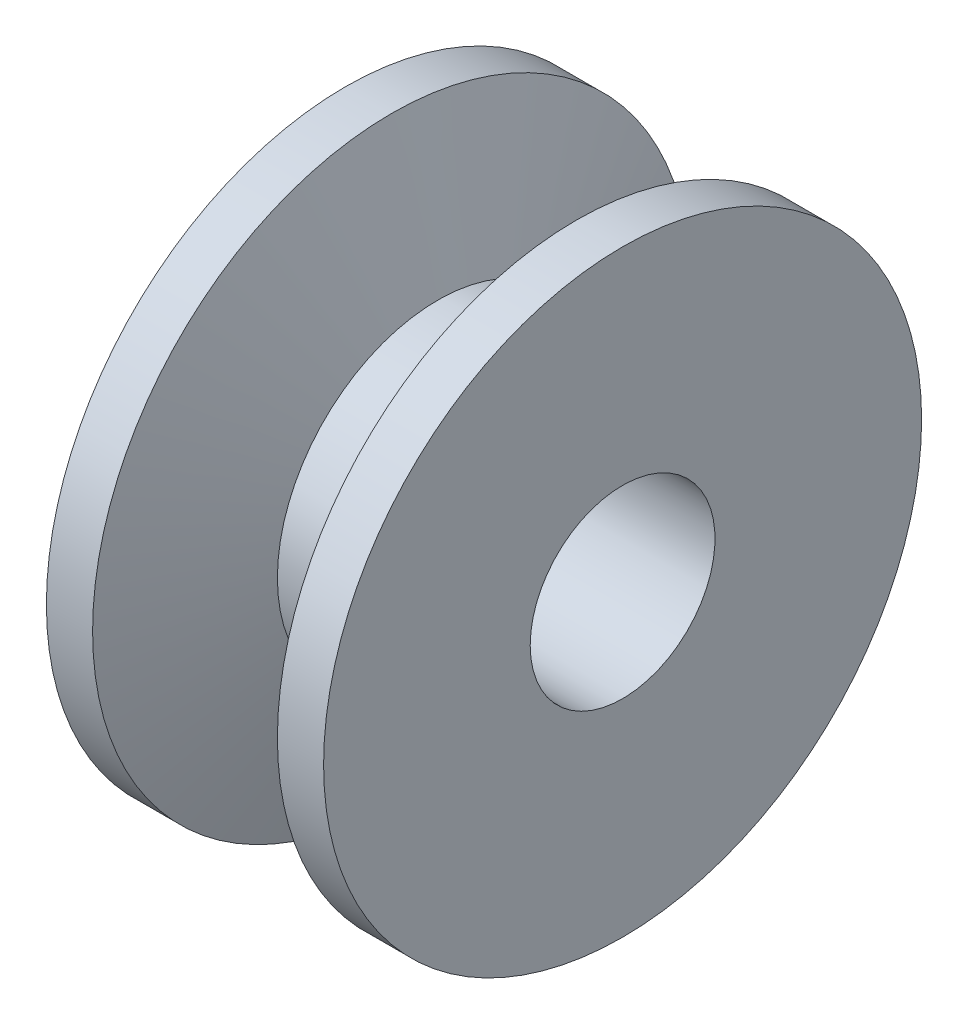
from build123d import *


with BuildPart() as part:
    # Esquisse1 → Révolution1 (revolve)
    with BuildSketch(Plane.XY, mode=Mode.PRIVATE) as r_volution1_sk:
        Polygon((-3, 3.750453515), (3, 3.750453515), (3, 8.222332364), (2, 8.222332364), (1, 5.222332364), (-1, 5.222332364), (-2, 8.222332364), (-3, 8.222332364), align=None)
    revolve(r_volution1_sk.sketch.rotate(Axis((-9.751832838, 1.750453515, 0), (1, 0, 0)), 90), axis=Axis((-9.751832838, 1.750453515, 0), (1, 0, 0)))


solid = part.part
